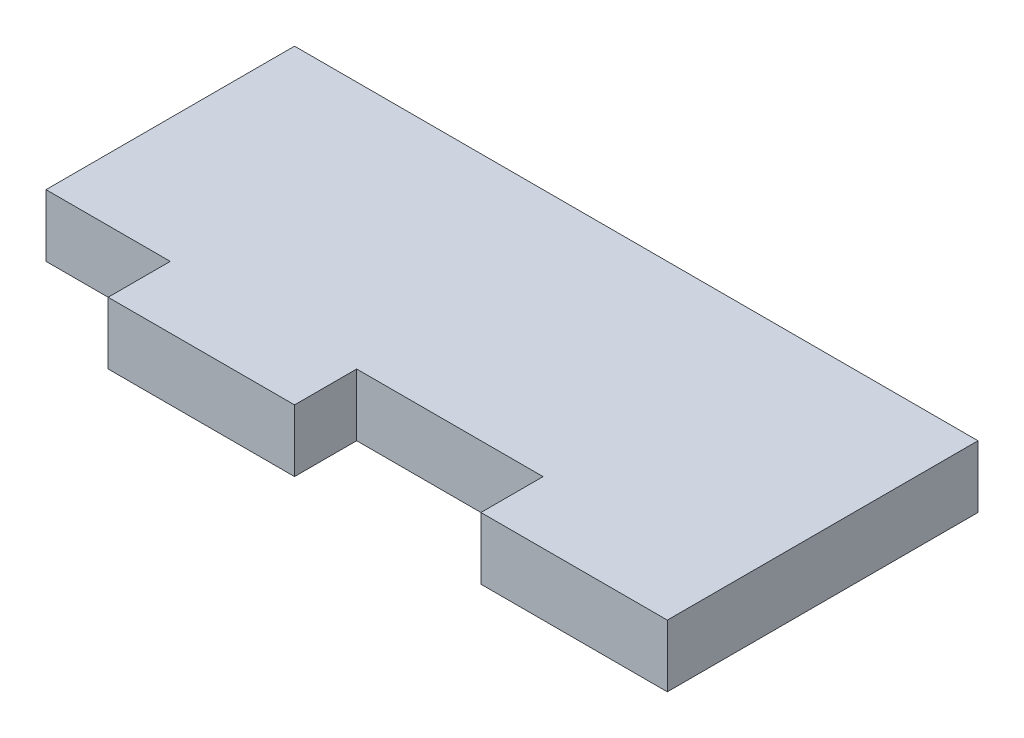
from build123d import *

# Parameters (mm, degrees)
BOSS_EXTRUDE1_DEPTH = 6.35


with BuildPart() as part:
    # Sketch1 → Boss-Extrude1 (new body)
    with BuildSketch(Plane(origin=(0, 0, 0), x_dir=(1, 0, 0), z_dir=(0, 1, 0))):
        Polygon((-69.85, 25.4), (0, 25.4), (0, -6.35), (-19.05, -6.35), (-19.05, 0), (-38.1, 0), (-38.1, -6.35), (-57.15, -6.35), (-57.15, 0), (-69.85, 0), align=None)
    extrude(amount=BOSS_EXTRUDE1_DEPTH)


solid = part.part
